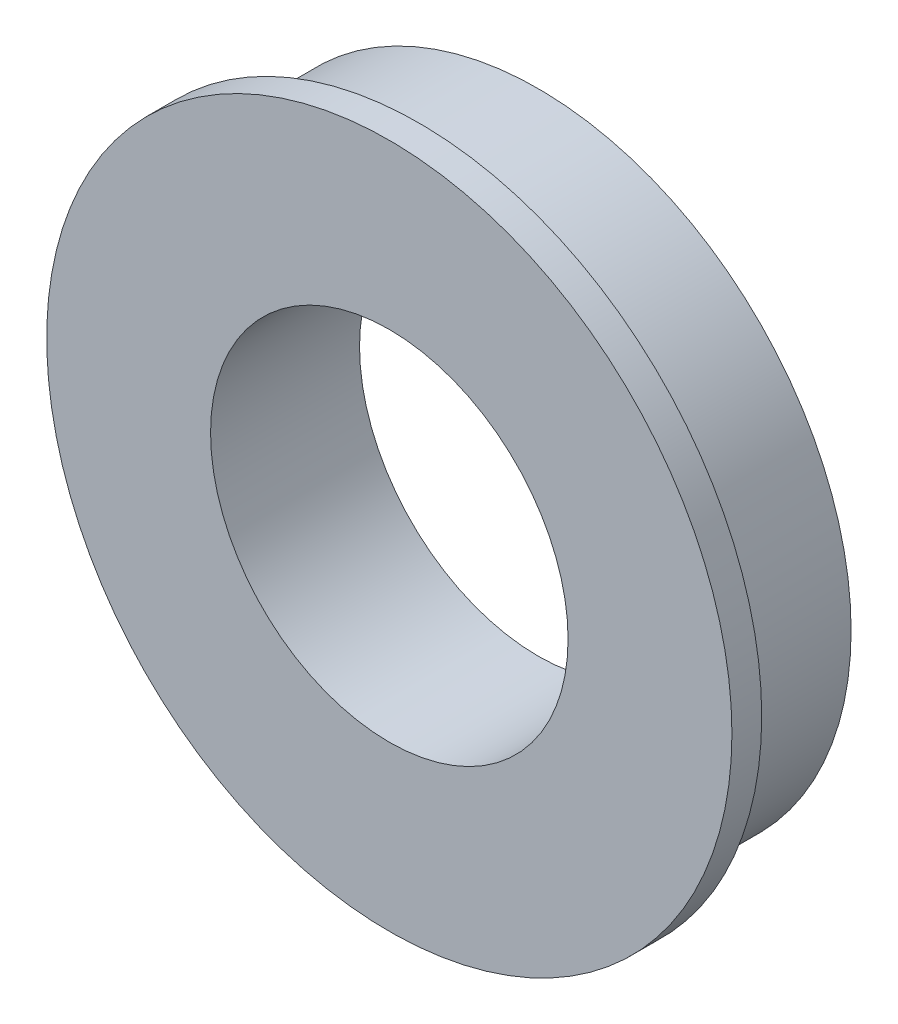
from build123d import *

# Parameters (mm, degrees)
SKETCH_1_R      = 10.5
SKETCH_1_R_2    = 6
EXTRUDE_1_DEPTH = 4
SKETCH_2_R      = 11.5
SKETCH_2_R_2    = 6
EXTRUDE_2_DEPTH = 1


with BuildPart() as part:
    # 草图1 → 凸台-拉伸1 (new body)
    with BuildSketch(Plane.XY):
        Circle(SKETCH_1_R)
        Circle(SKETCH_1_R_2, mode=Mode.SUBTRACT)
    extrude(amount=EXTRUDE_1_DEPTH)

    # 草图2 → 凸台-拉伸2 (add)
    with BuildSketch(Plane.XY.offset(4)):
        Circle(SKETCH_2_R)
        Circle(SKETCH_2_R_2, mode=Mode.SUBTRACT)
    extrude(amount=EXTRUDE_2_DEPTH)


solid = part.part
